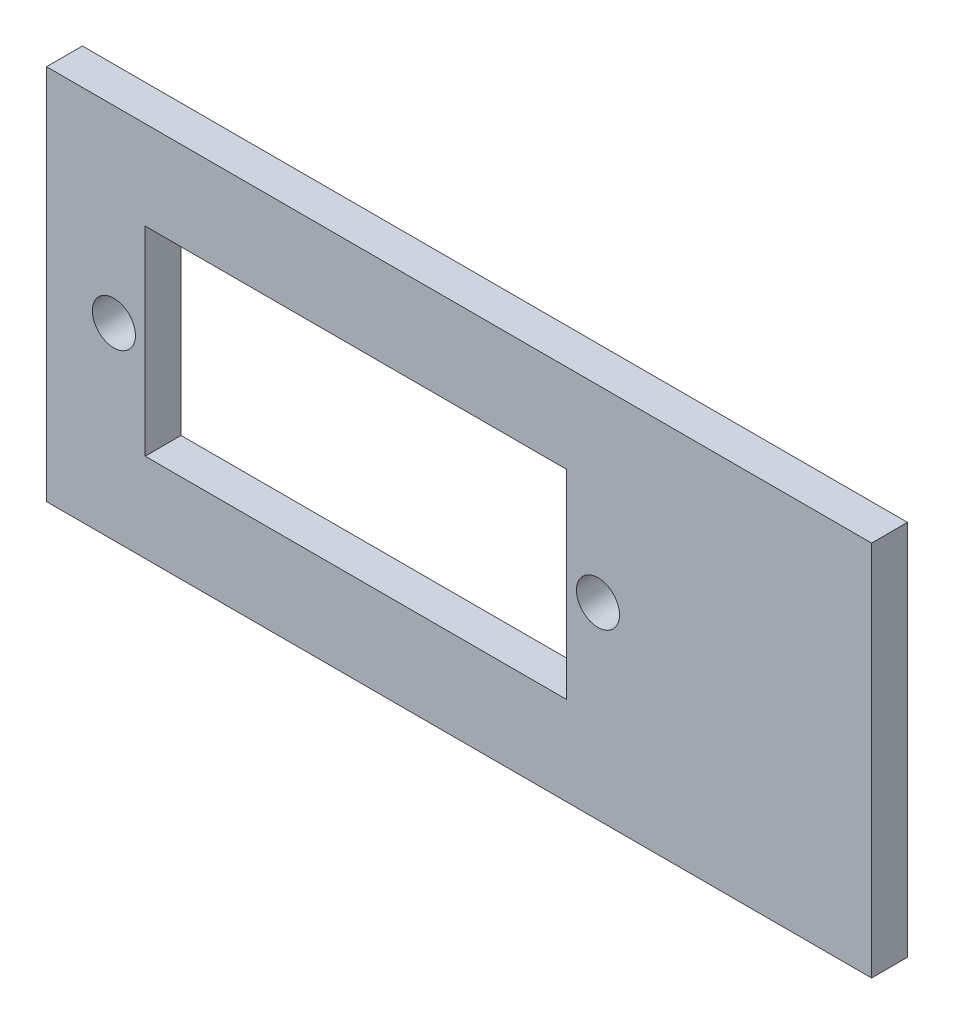
from build123d import *

# Parameters (mm, degrees)
SKETCH1_W           = 230
SKETCH1_H           = 105
BOSS_EXTRUDE1_DEPTH = 10
SKETCH2_R           = 6
SKETCH2_W           = 117.5
SKETCH2_H           = 55.55
CUT_EXTRUDE3_DEPTH  = 10


with BuildPart() as part:
    # Sketch1 → Boss-Extrude1 (new body)
    with BuildSketch(Plane.XY):
        Rectangle(SKETCH1_W, SKETCH1_H)
    extrude(amount=BOSS_EXTRUDE1_DEPTH)

    # Sketch2 → Cut-Extrude3 (cut)
    with BuildSketch(Plane.XY.offset(10)):
        with Locations((38.725, 0)):
            Circle(SKETCH2_R)
        with Locations((-96.225, 0)):
            Circle(SKETCH2_R)
        with Locations((-28.75, 0)):
            Rectangle(SKETCH2_W, SKETCH2_H)
    extrude(amount=-CUT_EXTRUDE3_DEPTH, mode=Mode.SUBTRACT)


solid = part.part
